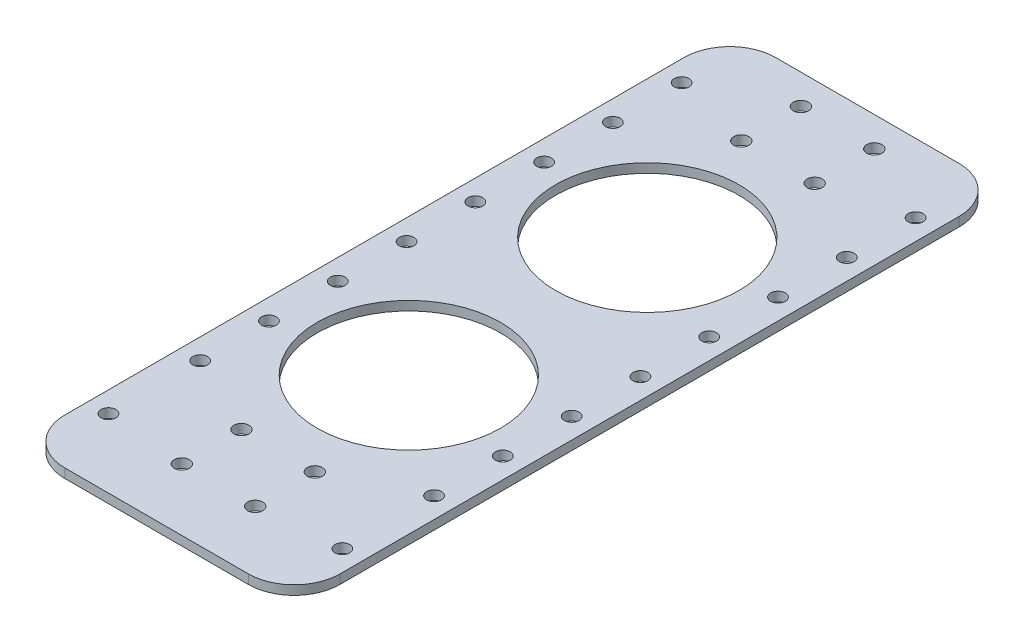
from build123d import *

# Parameters (mm, degrees)
SKETCH_1_W          = 60
SKETCH_1_H          = 80
EXTRUDE_1_DEPTH     = 2
SKETCH_2_R          = 1.4
CUT_EXTRUDE_1_DEPTH = 50
SKETCH_3_R          = 2
CUT_EXTRUDE_2_DEPTH = 50
SKETCH_5_W          = 60
SKETCH_5_H          = 40
EXTRUDE_2_DEPTH     = 2
SKETCH_6_R          = 20
CUT_EXTRUDE_4_DEPTH = 50
SKETCH_4_R          = 1.65
CUT_EXTRUDE_3_DEPTH = 50
SKETCH_7_R          = 1.6
CUT_EXTRUDE_5_DEPTH = 10
SKETCH_11_W         = 60
SKETCH_11_H         = 35
EXTRUDE_3_DEPTH     = 2
FILLET_1_R          = 10
SKETCH_13_R         = 1.6
CUT_EXTRUDE_6_DEPTH = 10
SKETCH_17_R         = 1.6
CUT_EXTRUDE_7_DEPTH = 10


with BuildPart() as part:
    # 草图1 → 凸台-拉伸1 (new body)
    with BuildSketch(Plane(origin=(0, 0, 0), x_dir=(1, 0, 0), z_dir=(0, 1, 0))):
        Rectangle(SKETCH_1_W, SKETCH_1_H)
    extrude(amount=EXTRUDE_1_DEPTH)

    # 草图2 → 切除-拉伸1 (cut)
    with BuildSketch(Plane(origin=(0, 2, 0), x_dir=(1, 0, 0), z_dir=(0, 1, 0))):
        with Locations(Location((0, -10.50070918, 0), (0, 0, 270))):
            Circle(SKETCH_2_R)
        with Locations(Location((9.49929082, -20, 0), (0, 0, 270))):
            Circle(SKETCH_2_R)
        with Locations(Location((0, -29.49929082, 0), (0, 0, 270))):
            Circle(SKETCH_2_R)
        with Locations(Location((-9.49929082, -20, 0), (0, 0, 270))):
            Circle(SKETCH_2_R)
    extrude(amount=-CUT_EXTRUDE_1_DEPTH, mode=Mode.SUBTRACT)

    # 草图3 → 切除-拉伸2 (cut)
    with BuildSketch(Plane(origin=(0, 2, 0), x_dir=(1, 0, 0), z_dir=(0, 1, 0))):
        with Locations(Location((0, -20, 0), (0, 0, 270))):
            Circle(SKETCH_3_R)
    extrude(amount=-CUT_EXTRUDE_2_DEPTH, mode=Mode.SUBTRACT)

    # 草图5 → 凸台-拉伸2 (add)
    with BuildSketch(Plane(origin=(0, 2, 0), x_dir=(1, 0, 0), z_dir=(0, 1, 0))):
        with Locations((0, 60)):
            Rectangle(SKETCH_5_W, SKETCH_5_H)
    extrude(amount=-EXTRUDE_2_DEPTH)

    # 草图6 → 切除-拉伸4 (cut)
    with BuildSketch(Plane(origin=(0, 2, 0), x_dir=(1, 0, 0), z_dir=(0, 1, 0))):
        with Locations(Location((0, 32, 0), (0, 0, 270))):
            Circle(SKETCH_6_R)
    cut_extrude_4 = extrude(amount=-CUT_EXTRUDE_4_DEPTH, mode=Mode.SUBTRACT)

    # 草图4 → 切除-拉伸3 (cut)
    with BuildSketch(Plane(origin=(0, 2, 0), x_dir=(1, 0, 0), z_dir=(0, 1, 0))):
        with Locations(Location((-8, 73.5, 0), (0, 0, 270))):
            Circle(SKETCH_4_R)
        with Locations(Location((8, 73.5, 0), (0, 0, 270))):
            Circle(SKETCH_4_R)
        with Locations(Location((8, 60.5, 0), (0, 0, 270))):
            Circle(SKETCH_4_R)
        with Locations(Location((-8, 60.5, 0), (0, 0, 270))):
            Circle(SKETCH_4_R)
    cut_extrude_3 = extrude(amount=-CUT_EXTRUDE_3_DEPTH, mode=Mode.SUBTRACT)

    # 草图7 → 切除-拉伸5 (cut)
    with BuildSketch(Plane(origin=(0, 2, 0), x_dir=(1, 0, 0), z_dir=(0, 1, 0))):
        with Locations(Location((-25.5, 20, 0), (0, 0, 270))):
            Circle(SKETCH_7_R)
        with Locations(Location((-25.5, 5, 0), (0, 0, 270))):
            Circle(SKETCH_7_R)
        with Locations(Location((-25.5, -10, 0), (0, 0, 270))):
            Circle(SKETCH_7_R)
        with Locations(Location((-25.5, -25, 0), (0, 0, 270))):
            Circle(SKETCH_7_R)
        with Locations(Location((-25.5, 35, 0), (0, 0, 270))):
            Circle(SKETCH_7_R)
        with Locations(Location((-25.5, 50, 0), (0, 0, 270))):
            Circle(SKETCH_7_R)
        with Locations(Location((-25.5, 65, 0), (0, 0, 270))):
            Circle(SKETCH_7_R)
        with Locations(Location((25.5, 65, 0), (0, 0, 270))):
            Circle(SKETCH_7_R)
        with Locations(Location((25.5, 50, 0), (0, 0, 270))):
            Circle(SKETCH_7_R)
        with Locations(Location((25.5, 35, 0), (0, 0, 270))):
            Circle(SKETCH_7_R)
        with Locations(Location((25.5, -25, 0), (0, 0, 270))):
            Circle(SKETCH_7_R)
        with Locations(Location((25.5, -10, 0), (0, 0, 270))):
            Circle(SKETCH_7_R)
        with Locations(Location((25.5, 5, 0), (0, 0, 270))):
            Circle(SKETCH_7_R)
        with Locations(Location((25.5, 20, 0), (0, 0, 270))):
            Circle(SKETCH_7_R)
    extrude(amount=-CUT_EXTRUDE_5_DEPTH, mode=Mode.SUBTRACT)

    # 草图11 → 凸台-拉伸3 (add)
    with BuildSketch(Plane(origin=(0, 2, 0), x_dir=(1, 0, 0), z_dir=(0, 1, 0))):
        with Locations((0, -57.5)):
            Rectangle(SKETCH_11_W, SKETCH_11_H)
    extrude(amount=-EXTRUDE_3_DEPTH)

    # 镜向2: 切除-拉伸4, 切除-拉伸3 across plane
    add(cut_extrude_4.mirror(Plane.XY.offset(-6)), mode=Mode.SUBTRACT)
    add(cut_extrude_3.mirror(Plane.XY.offset(-6)), mode=Mode.SUBTRACT)

    # 圆角1
    fillet_1_edges = [part.edges().sort_by_distance(p)[0] for p in [
        (-30, 1, 75),
        (30, 1, 75),
        (-30, 1, -80),
        (30, 1, -80),
    ]]
    fillet(fillet_1_edges, radius=FILLET_1_R)

    # 草图13 → 切除-拉伸6 (cut)
    with BuildSketch(Plane(origin=(0, 0, 0), x_dir=(-1, 0, 0), z_dir=(0, -1, 0))):
        with Locations(Location((-25.5, -60, 0), (0, 0, 90))):
            Circle(SKETCH_13_R)
        with Locations(Location((25.5, -60, 0), (0, 0, 270))):
            Circle(SKETCH_13_R)
    extrude(amount=-CUT_EXTRUDE_6_DEPTH, mode=Mode.SUBTRACT)

    # 草图17 → 切除-拉伸7 (cut)
    with BuildSketch(Plane(origin=(0, 2, 0), x_dir=(1, 0, 0), z_dir=(0, 1, 0))):
        with Locations(Location((-25.5, -40, 0), (0, 0, 270))):
            Circle(SKETCH_17_R)
        with Locations(Location((25.5, -40, 0), (0, 0, 270))):
            Circle(SKETCH_17_R)
    extrude(amount=-CUT_EXTRUDE_7_DEPTH, mode=Mode.SUBTRACT)


solid = part.part
